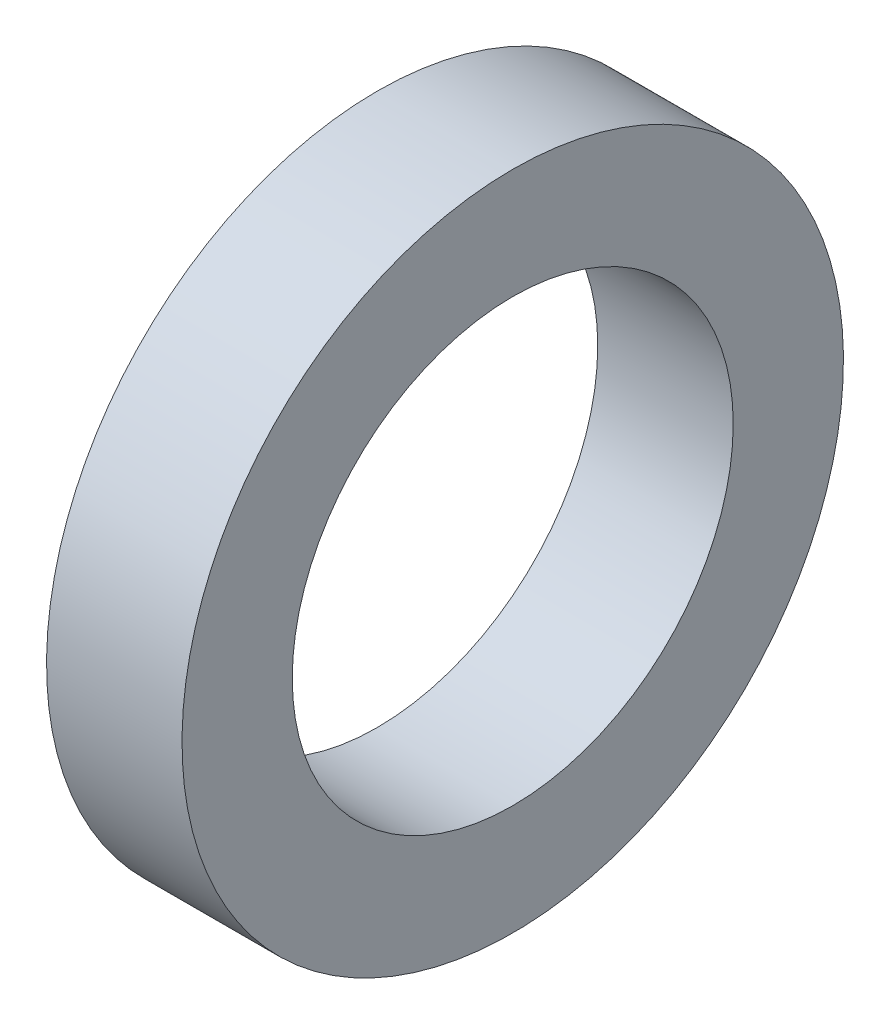
from build123d import *

# Parameters (mm, degrees)
SKETCH1_W = 3.90144
SKETCH1_H = 3.175


with BuildPart() as part:
    # Sketch1 → Revolve1 (revolve)
    with BuildSketch(Plane.XY):
        with Locations((1.95072, 7.9375)):
            Rectangle(SKETCH1_W, SKETCH1_H)
    revolve(axis=Axis((3.90144, 0, 0), (-1, 0, 0)))


solid = part.part
